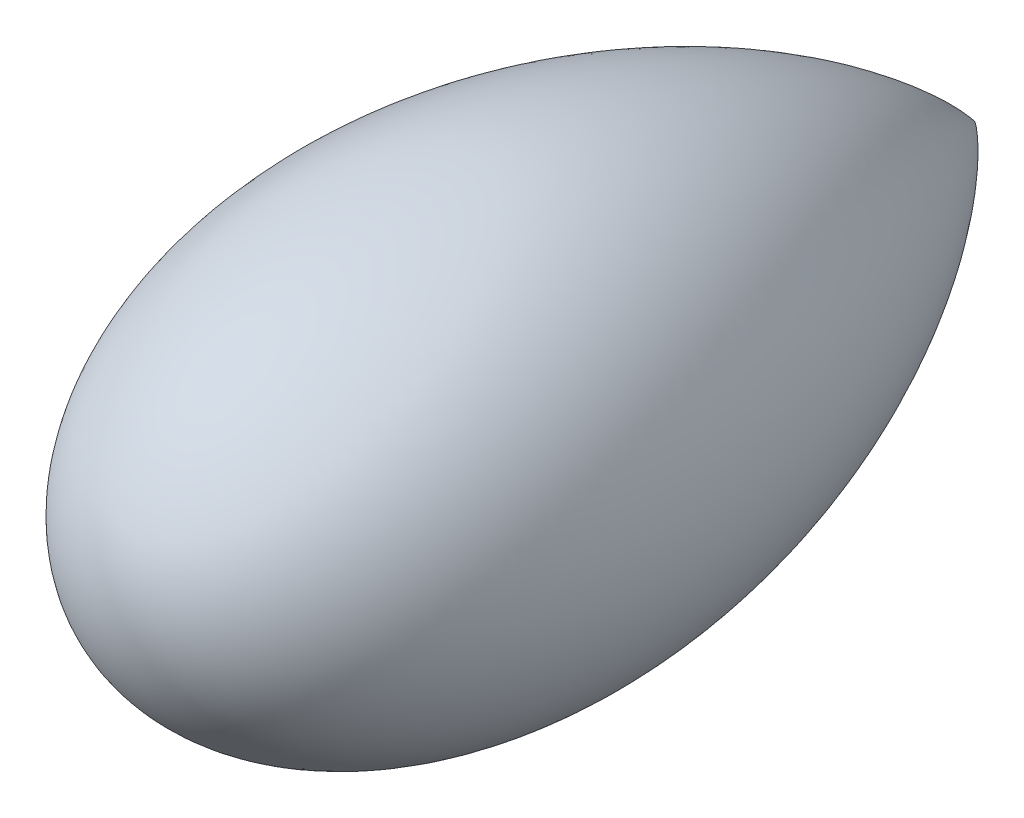
from build123d import *


with BuildPart() as part:
    # Sketch1 → Revolve2 (revolve)
    with BuildSketch(Plane(origin=(0, 0, 0), x_dir=(1, 0, 0), z_dir=(0, 1, 0))):
        with BuildLine():
            Line((0, -21.322719236), (0, 0))
            add(Edge.make_bspline(
                [(0, -21.322719236), (0.060560085, -21.322719236), (0.180524471, -21.319641649), (0.367253436, -21.308100733), (0.555099954, -21.282853848), (0.716031376, -21.254354484), (0.844484832, -21.227146087), (1.003846681, -21.187722617), (1.192255978, -21.131930628), (1.409866449, -21.054385642), (1.653582017, -20.949537987), (1.919546295, -20.814989856), (2.203814395, -20.645534877), (2.500375521, -20.437465388), (2.804071515, -20.18724564), (3.160204704, -19.848070385), (3.550022854, -19.404299118), (3.951266169, -18.843731114), (4.436649613, -17.990557301), (4.891487265, -16.901787031), (5.256261672, -15.573480044), (5.476304842, -14.015582065), (5.522754746, -12.440907235), (5.413254634, -10.86984723), (5.161408842, -9.315567419), (4.777436956, -7.788735484), (4.268755831, -6.29890695), (3.640339299, -4.8554832), (2.894569991, -3.468935157), (2.142562223, -2.322832876), (1.4261444, -1.402229764), (0.851142921, -0.768816275), (0.46258063, -0.387077098), (0.195923127, -0.152384325), (0.066311735, -0.049533063), (0, 0)],
                knots=[0.075727274, 0.075727274, 0.075727274, 0.075727274, 0.075727274, 0.08522519, 0.094723107, 0.099472069, 0.104221032, 0.108969994, 0.113718957, 0.12321688, 0.132714803, 0.142432648, 0.152150492, 0.166397447, 0.180644402, 0.194891233, 0.209138064, 0.237631811, 0.266125768, 0.294619399, 0.351197461, 0.40818511, 0.465172649, 0.522160251, 0.579147823, 0.636135418, 0.693122968, 0.750110546, 0.807098279, 0.864085824, 0.921073538, 0.948543207, 0.976012876, 0.988006438, 1, 1, 1, 1, 1], degree=4))
        make_face()
    revolve(axis=Axis((0, 0, 0), (0, 0, 1)))


solid = part.part
